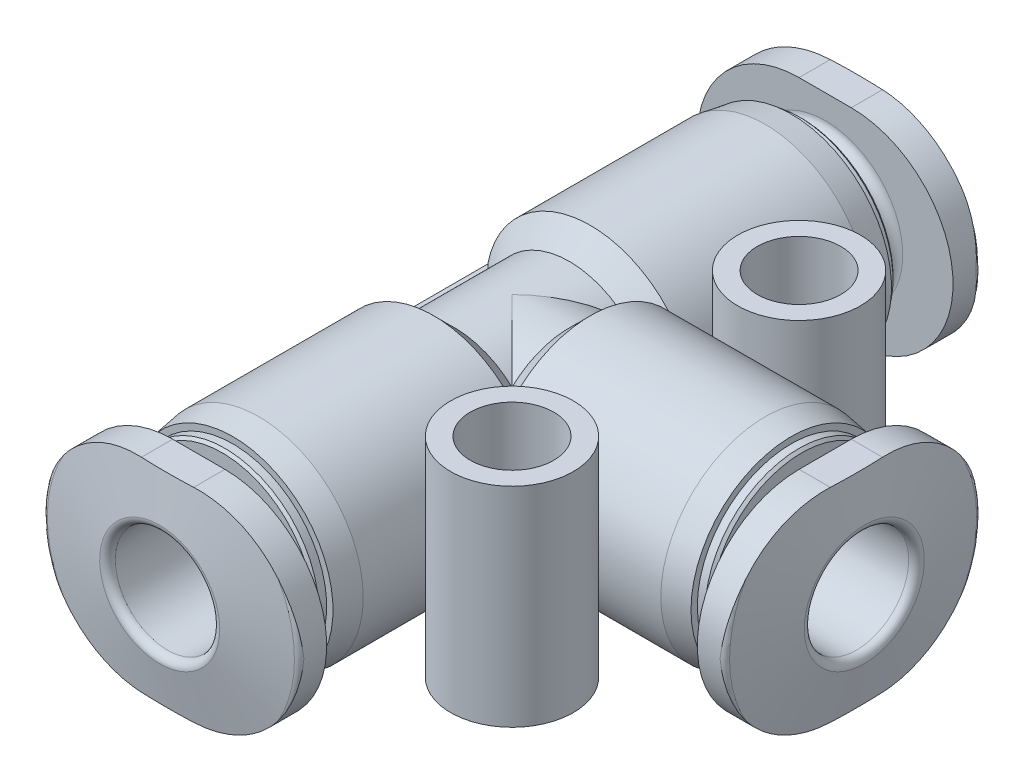
from build123d import *

# Parameters (mm, degrees)
SKETCH2_W                = 40
SKETCH2_H                = 40
CUT_EXTRUDE1_DEPTH       = 1.5
CUT_EXTRUDE2_START       = -1.5
SKETCH3_W                = 40
SKETCH3_H                = 40
CUT_EXTRUDE2_DEPTH       = 1.5
SKETCH5_W                = 40
SKETCH5_H                = 40
CUT_EXTRUDE3_DEPTH       = 1.5
BOSS_EXTRUDE1_DEPTH      = 3
BOSS_EXTRUDE1_DEPTH_BACK = 3
SKETCH7_W                = 2.35
SKETCH7_H                = 8
SKETCH8_W                = 2.35
SKETCH8_H                = 8
SKETCH9_W                = 1.6
SKETCH9_H                = 8
SKETCH10_W               = 1.6
SKETCH10_H               = 8


with BuildPart() as part:
    # Sketch1 → Revolve1 (revolve)
    with BuildSketch(Plane(origin=(0, 0, 0), x_dir=(0, 0, -1), z_dir=(1, 0, 0)), mode=Mode.PRIVATE) as revolve1_sk:
        with BuildLine():
            Line((-13.5, 0), (-13.5, 2.3))
            Line((-13.5, 2.3), (-13.070691475, 4.734729636))
            ThreePointArc((-13.070691475, 4.734729636), (-13.002287446, 4.853208889), (-12.873729924, 4.9))
            Line((-12.873729924, 4.9), (-12, 4.9))
            Line((-12, 4.9), (-12, 2.975))
            ThreePointArc((-12, 2.975), (-11.890165043, 2.709834957), (-11.625, 2.6))
            Line((-11.625, 2.6), (-11.1, 2.6))
            Line((-11.1, 2.6), (-11.1, 3.5))
            Line((-11.1, 3.5), (-11, 3.6))
            Line((-11, 3.6), (-10.7, 3.6))
            Line((-10.7, 3.6), (-10.7, 3.84161556))
            Line((-10.7, 3.84161556), (-9.7, 4))
            Line((-9.7, 4), (-3, 4))
            Line((-3, 4), (-2.2, 3.2))
            Line((-2.2, 3.2), (2.2, 3.2))
            Line((2.2, 3.2), (3, 4))
            Line((3, 4), (9.7, 4))
            Line((9.7, 4), (10.7, 3.84161556))
            Line((10.7, 3.84161556), (10.7, 3.6))
            Line((10.7, 3.6), (11, 3.6))
            Line((11, 3.6), (11.1, 3.5))
            Line((11.1, 3.5), (11.1, 2.6))
            Line((11.1, 2.6), (11.625, 2.6))
            ThreePointArc((11.625, 2.6), (11.890165043, 2.709834957), (12, 2.975))
            Line((12, 2.975), (12, 4.9))
            Line((12, 4.9), (12.873729924, 4.9))
            ThreePointArc((12.873729924, 4.9), (13.002287446, 4.853208889), (13.070691475, 4.734729636))
            Line((13.070691475, 4.734729636), (13.5, 2.3))
            Line((13.5, 2.3), (13.5, 0))
            Line((13.5, 0), (-13.5, 0))
        make_face()
    revolve(revolve1_sk.sketch.rotate(Axis((0, 0, -13.5), (0, 0, 1)), 90), axis=Axis((0, 0, -13.5), (0, 0, 1)))

    # Sketch2 → Cut-Extrude1 (cut)
    with BuildSketch(Plane.XY.offset(-13.5)):
        Rectangle(SKETCH2_W, SKETCH2_H)
        with BuildLine():
            Line((-1, -3.9), (1, -3.9))
            ThreePointArc((1, -3.9), (4.9, 0), (1, 3.9))
            Line((1, 3.9), (-1, 3.9))
            ThreePointArc((-1, 3.9), (-4.9, 0), (-1, -3.9))
        make_face(mode=Mode.SUBTRACT)
    extrude(amount=CUT_EXTRUDE1_DEPTH, mode=Mode.SUBTRACT)

    # Sketch3 → Cut-Extrude2 (cut)
    with BuildSketch(Plane.XY.offset(13.5).offset(CUT_EXTRUDE2_START)):
        Rectangle(SKETCH3_W, SKETCH3_H)
        with BuildLine():
            Line((-1, -3.9), (1, -3.9))
            ThreePointArc((1, -3.9), (4.9, 0), (1, 3.9))
            Line((1, 3.9), (-1, 3.9))
            ThreePointArc((-1, 3.9), (-4.9, 0), (-1, -3.9))
        make_face(mode=Mode.SUBTRACT)
    extrude(amount=CUT_EXTRUDE2_DEPTH, mode=Mode.SUBTRACT)

    # Sketch4 → Revolve2 (revolve)
    with BuildSketch(Plane(origin=(0, 0, 0), x_dir=(1, 0, 0), z_dir=(0, 1, 0)), mode=Mode.PRIVATE) as revolve2_sk:
        with BuildLine():
            Line((0, 0), (0, 3.2))
            Line((0, 3.2), (2.2, 3.2))
            Line((2.2, 3.2), (3, 4))
            Line((3, 4), (9.7, 4))
            Line((9.7, 4), (10.7, 3.84161556))
            Line((10.7, 3.84161556), (10.7, 3.6))
            Line((10.7, 3.6), (11, 3.6))
            Line((11, 3.6), (11.1, 3.5))
            Line((11.1, 3.5), (11.1, 2.6))
            Line((11.1, 2.6), (11.625, 2.6))
            ThreePointArc((11.625, 2.6), (11.890165043, 2.709834957), (12, 2.975))
            Line((12, 2.975), (12, 4.9))
            Line((12, 4.9), (12.873729924, 4.9))
            ThreePointArc((12.873729924, 4.9), (13.002287446, 4.853208889), (13.070691475, 4.734729636))
            Line((13.070691475, 4.734729636), (13.5, 2.3))
            Line((13.5, 2.3), (13.5, 0))
            Line((13.5, 0), (0, 0))
        make_face()
    revolve(revolve2_sk.sketch.rotate(Axis((13.5, 0, 0), (-1, 0, 0)), 180), axis=Axis((13.5, 0, 0), (-1, 0, 0)))

    # Sketch5 → Cut-Extrude3 (cut)
    with BuildSketch(Plane(origin=(13.5, 0, 0), x_dir=(0, 0, -1), z_dir=(1, 0, 0))):
        Rectangle(SKETCH5_W, SKETCH5_H)
        with BuildLine():
            Line((-1, -3.9), (1, -3.9))
            ThreePointArc((1, -3.9), (4.9, 0), (1, 3.9))
            Line((1, 3.9), (-1, 3.9))
            ThreePointArc((-1, 3.9), (-4.9, 0), (-1, -3.9))
        make_face(mode=Mode.SUBTRACT)
    extrude(amount=-CUT_EXTRUDE3_DEPTH, mode=Mode.SUBTRACT)

    # Sketch6 → Boss-Extrude1 (add, two sides: drawn at the far end of the back side and taken through both)
    with BuildSketch(Plane.XY.offset(-BOSS_EXTRUDE1_DEPTH_BACK)):
        with BuildLine():
            Line((-3.929058411, -0.75), (0, -0.75))
            Line((0, -0.75), (0, 0.75))
            Line((0, 0.75), (-3.929058411, 0.75))
            ThreePointArc((-3.929058411, 0.75), (-4, 0), (-3.929058411, -0.75))
        make_face()
    extrude(amount=BOSS_EXTRUDE1_DEPTH + BOSS_EXTRUDE1_DEPTH_BACK)

    # Sketch7 → Revolve3 (revolve)
    with BuildSketch(Plane(origin=(5.5, 0, 0), x_dir=(0, 0, -1), z_dir=(1, 0, 0)), mode=Mode.PRIVATE) as revolve3_sk:
        with Locations((-6.675, 0)):
            Rectangle(SKETCH7_W, SKETCH7_H)
    revolve(revolve3_sk.sketch.rotate(Axis((5.5, 4, 5.5), (0, -1, 0)), 180), axis=Axis((5.5, 4, 5.5), (0, -1, 0)))

    # Sketch8 → Revolve4 (revolve)
    with BuildSketch(Plane(origin=(5.5, 0, 0), x_dir=(0, 0, -1), z_dir=(1, 0, 0)), mode=Mode.PRIVATE) as revolve4_sk:
        with Locations((4.325, 0)):
            Rectangle(SKETCH8_W, SKETCH8_H)
    revolve(revolve4_sk.sketch.rotate(Axis((5.5, 4, -5.5), (0, -1, 0)), 180), axis=Axis((5.5, 4, -5.5), (0, -1, 0)))

    # Sketch9 → Cut-Revolve1 (revolve, cut)
    with BuildSketch(Plane(origin=(5.5, 0, 0), x_dir=(0, 0, -1), z_dir=(1, 0, 0)), mode=Mode.PRIVATE) as cut_revolve1_sk:
        with Locations((-6.3, 0)):
            Rectangle(SKETCH9_W, SKETCH9_H)
    revolve(cut_revolve1_sk.sketch.rotate(Axis((5.5, 4, 5.5), (0, -1, 0)), 180), axis=Axis((5.5, 4, 5.5), (0, -1, 0)), mode=Mode.SUBTRACT)

    # Sketch10 → Cut-Revolve2 (revolve, cut)
    with BuildSketch(Plane(origin=(5.5, 0, 0), x_dir=(0, 0, -1), z_dir=(1, 0, 0)), mode=Mode.PRIVATE) as cut_revolve2_sk:
        with Locations((4.7, 0)):
            Rectangle(SKETCH10_W, SKETCH10_H)
    revolve(cut_revolve2_sk.sketch.rotate(Axis((5.5, 4, -5.5), (0, -1, 0)), 180), axis=Axis((5.5, 4, -5.5), (0, -1, 0)), mode=Mode.SUBTRACT)

    # Sketch11 → Cut-Revolve3 (revolve, cut)
    with BuildSketch(Plane(origin=(0, 0, 0), x_dir=(0, 0, -1), z_dir=(1, 0, 0)), mode=Mode.PRIVATE) as cut_revolve3_sk:
        with BuildLine():
            Line((-13.5, 0), (-13.5, 2.3))
            ThreePointArc((-13.5, 2.3), (-13.412132034, 2.087867966), (-13.2, 2))
            Line((-13.2, 2), (-2.1, 2))
            ThreePointArc((-2.1, 2), (-2.029289322, 1.970710678), (-2, 1.9))
            Line((-2, 1.9), (-2, 1.5))
            Line((-2, 1.5), (2, 1.5))
            Line((2, 1.5), (2, 1.9))
            ThreePointArc((2, 1.9), (2.029289322, 1.970710678), (2.1, 2))
            Line((2.1, 2), (13.2, 2))
            ThreePointArc((13.2, 2), (13.412132034, 2.087867966), (13.5, 2.3))
            Line((13.5, 2.3), (13.5, 0))
            Line((13.5, 0), (-13.5, 0))
        make_face()
    revolve(cut_revolve3_sk.sketch.rotate(Axis((0, 0, -13.5), (0, 0, 1)), 270), axis=Axis((0, 0, -13.5), (0, 0, 1)), mode=Mode.SUBTRACT)

    # Sketch12 → Cut-Revolve4 (revolve, cut)
    with BuildSketch(Plane(origin=(0, 0, 0), x_dir=(1, 0, 0), z_dir=(0, 1, 0)), mode=Mode.PRIVATE) as cut_revolve4_sk:
        with BuildLine():
            Line((0, 0), (0, 1.5))
            Line((0, 1.5), (2, 1.5))
            Line((2, 1.5), (2, 1.9))
            ThreePointArc((2, 1.9), (2.029289322, 1.970710678), (2.1, 2))
            Line((2.1, 2), (13.2, 2))
            ThreePointArc((13.2, 2), (13.412132034, 2.087867966), (13.5, 2.3))
            Line((13.5, 2.3), (13.5, 0))
            Line((13.5, 0), (0, 0))
        make_face()
    revolve(cut_revolve4_sk.sketch.rotate(Axis((13.5, 0, 0), (-1, 0, 0)), 180), axis=Axis((13.5, 0, 0), (-1, 0, 0)), mode=Mode.SUBTRACT)


solid = part.part
